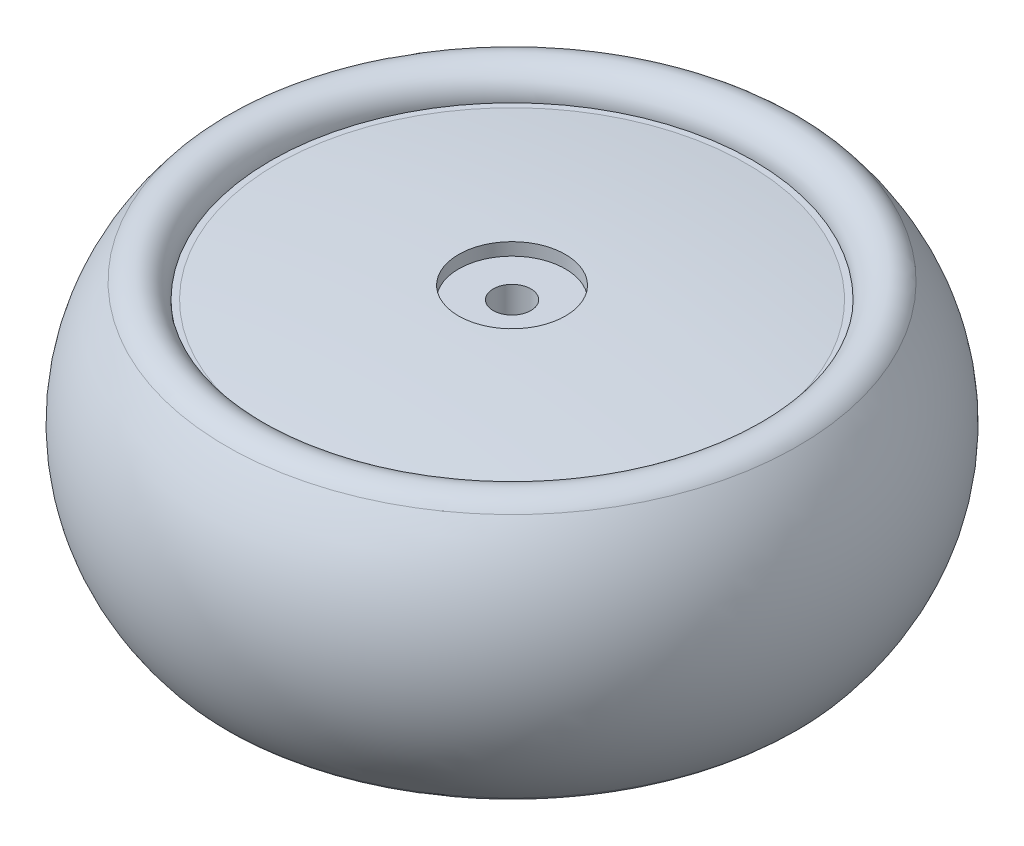
from build123d import *


with BuildPart() as part:
    # Sketch1 → Revolve1 (revolve)
    with BuildSketch(Plane(origin=(0, 0, 0), x_dir=(0, 0, -1), z_dir=(1, 0, 0)), mode=Mode.PRIVATE) as revolve1_sk:
        with BuildLine():
            Line((2.38125, 26.9875), (2.38125, 22.225))
            Line((2.38125, 22.225), (26.67, 22.225))
            Line((26.67, 22.225), (26.67, 0))
            Line((26.67, 0), (30.48, 0))
            Line((30.48, 0), (30.48, 26.9875))
            Line((30.48, 26.9875), (29.718, 26.9875))
            ThreePointArc((29.718, 26.9875), (18.250702386, 28.045542896), (6.746875, 28.575))
            Line((6.746875, 28.575), (6.746875, 26.9875))
            Line((6.746875, 26.9875), (2.38125, 26.9875))
        make_face()
    revolve(revolve1_sk.sketch.rotate(Axis((0, 88.356888739, 0), (0, -1, 0)), 180), axis=Axis((0, 88.356888739, 0), (0, -1, 0)))

    # Sketch2 → Revolve2 (revolve)
    with BuildSketch(Plane.XY, mode=Mode.PRIVATE) as revolve2_sk:
        with BuildLine():
            Line((-30.48, 26.9875), (-30.48, 0))
            ThreePointArc((-30.48, 0), (-32.585795222, -2.989552833), (-36.109874736, -2.013508141))
            ThreePointArc((-36.109874736, -2.013508141), (-41.656, 13.49375), (-36.109874736, 29.001008141))
            ThreePointArc((-36.109874736, 29.001008141), (-32.585795222, 29.977052833), (-30.48, 26.9875))
        make_face()
    revolve(revolve2_sk.sketch.rotate(Axis((0, -2.622836826, 0), (0, 1, 0)), 270), axis=Axis((0, -2.622836826, 0), (0, 1, 0)))


solid = part.part
